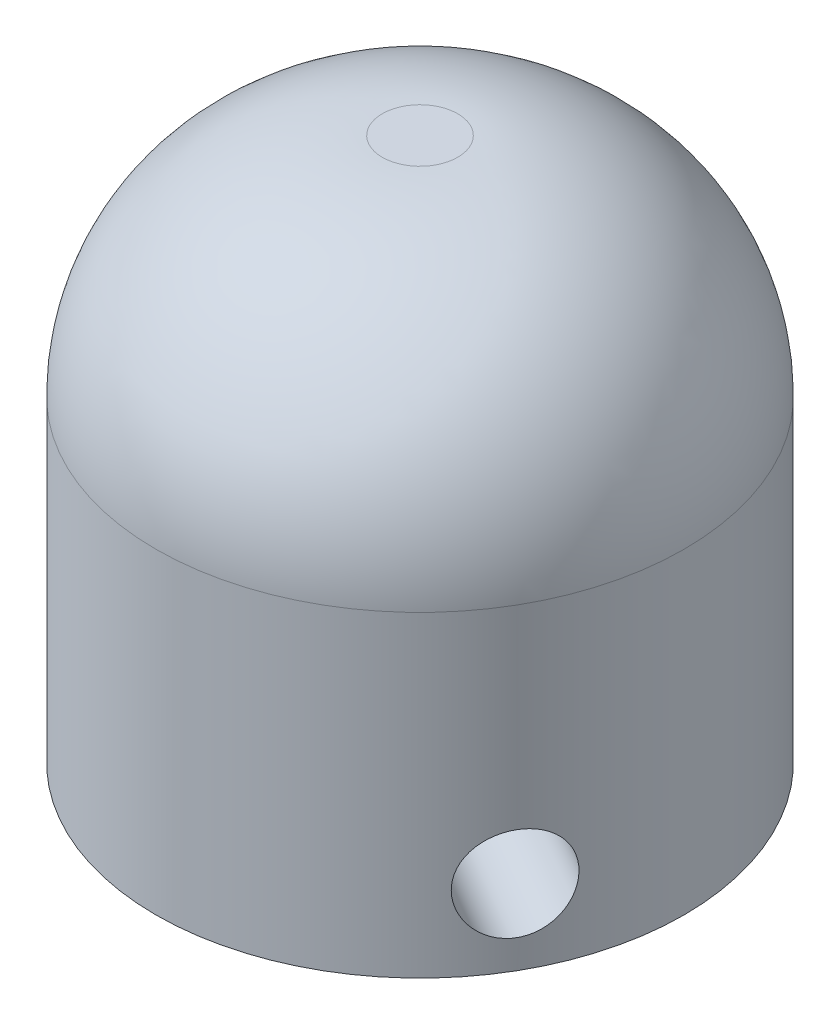
from build123d import *

# Parameters (mm, degrees)
ENL_V_START                  = -8
ESQUISSE2_R                  = 3.1
ENL_V_MAT_EXTRU_1_DEPTH      = 30
R_P_TITION_CIRCULAIRE1_COUNT = 3
CONG_1_R                     = 15


with BuildPart() as part:
    # Esquisse1 → Révolution1 (revolve)
    with BuildSketch(Plane.XY, mode=Mode.PRIVATE) as r_volution1_sk:
        Polygon((7.5, 20), (0, 32.990381057), (0, 35.990381057), (17.5, 35.990381057), (17.5, 0), (7.5, 0), align=None)
    revolve(r_volution1_sk.sketch.rotate(Axis((0, 0, 0), (0, 1, 0)), 90), axis=Axis((0, 0, 0), (0, 1, 0)))

    # Esquisse2 → Enlèv. mat.-Extru.1 (cut)
    with BuildSketch(Plane.XY.offset(ENL_V_START)):
        with Locations((0, 5)):
            Circle(ESQUISSE2_R)
    enl_v_mat_extru_1 = extrude(amount=-ENL_V_MAT_EXTRU_1_DEPTH, mode=Mode.SUBTRACT)

    # Répétition circulaire1: Enlèv. mat.-Extru.1 ×3 about axis
    r_p_tition_circulaire1_axis = Axis((0, 0, 0), (0, 1, 0))
    for i in range(1, R_P_TITION_CIRCULAIRE1_COUNT):
        add(enl_v_mat_extru_1.rotate(r_p_tition_circulaire1_axis, i * 360 / R_P_TITION_CIRCULAIRE1_COUNT), mode=Mode.SUBTRACT)

    # Congé1
    cong_1_edges = [part.edges().sort_by_distance(p)[0] for p in [
        (0, 35.990381057, 17.5),
    ]]
    fillet(cong_1_edges, radius=CONG_1_R)


solid = part.part
